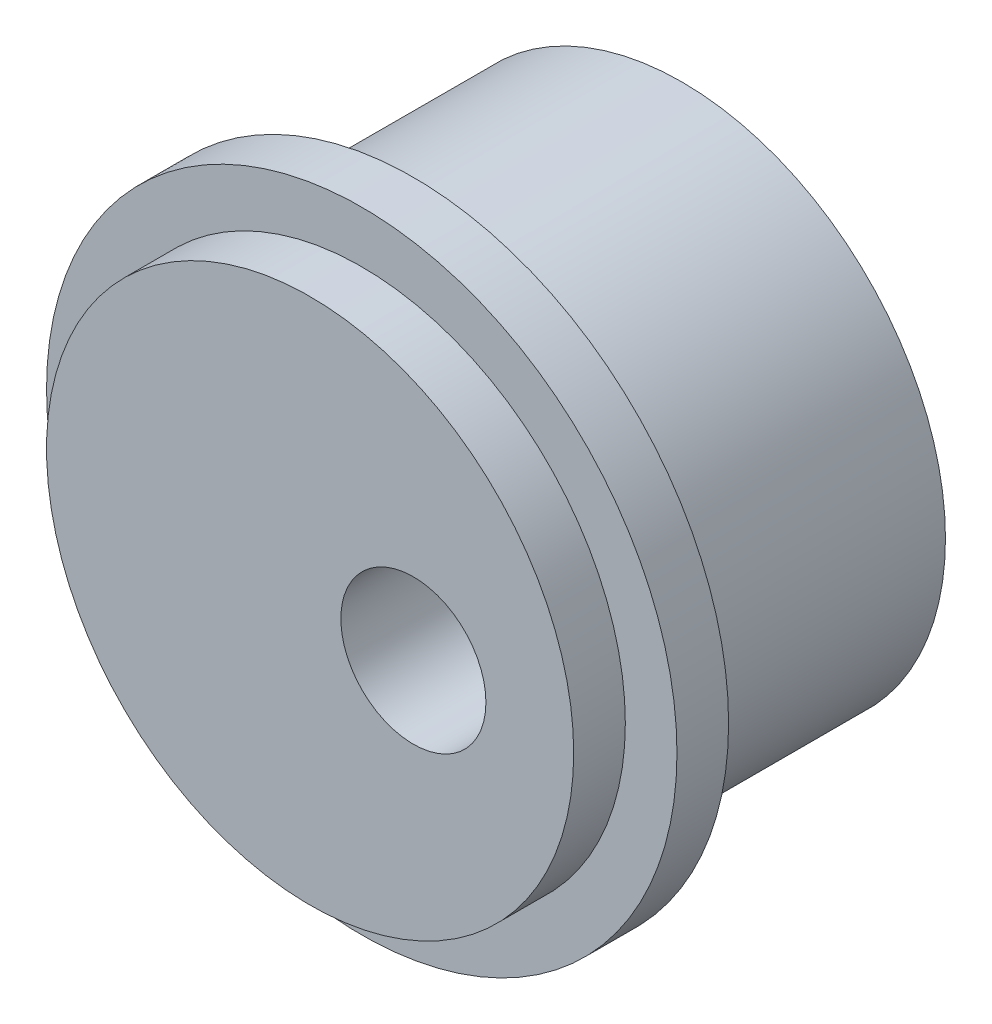
from build123d import *

# Parameters (mm, degrees)
SKETCH5_W           = 42.1
SKETCH5_H           = 42.1
SKETCH5_W_2         = 28.1
SKETCH5_H_2         = 28.1
BOSS_EXTRUDE3_DEPTH = 32
CUT_EXTRUDE2_REACH  = 80.495
SKETCH6_W           = 15
SKETCH6_H           = 10
SKETCH7_W           = 42.1
SKETCH7_H           = 42.1
SKETCH7_R           = 14.05
BOSS_EXTRUDE4_DEPTH = 40
CUT_EXTRUDE3_START  = -72
CUT_EXTRUDE3_DEPTH  = 72
CIRPATTERN1_COUNT   = 4
BOSS_EXTRUDE6_START = -72
SKETCH24_R          = 51.05
SKETCH24_R_2        = 21.05
BOSS_EXTRUDE6_DEPTH = 72
BOSS_EXTRUDE7_START = -20
SKETCH25_R          = 61.05
SKETCH25_R_2        = 51.05
BOSS_EXTRUDE7_DEPTH = 10


with BuildPart() as part:
    # Sketch5 → Boss-Extrude3 (new body)
    with BuildSketch(Plane.XY.offset(20)):
        with Locations((20, 0)):
            Rectangle(SKETCH5_W, SKETCH5_H)
        with Locations((20, 0)):
            Rectangle(SKETCH5_W_2, SKETCH5_H_2, mode=Mode.SUBTRACT)
    extrude(amount=BOSS_EXTRUDE3_DEPTH)

    # Sketch6 → Cut-Extrude2 (cut, up to next)
    with BuildSketch(Plane(origin=(0, 21.05, 0), x_dir=(1, 0, 0), z_dir=(0, 1, 0)), mode=Mode.PRIVATE) as cut_extrude2_sk1:
        with Locations((20, -27.5)):
            Rectangle(SKETCH6_W, SKETCH6_H)
    cut_extrude2_tool1 = extrude(cut_extrude2_sk1.sketch, amount=-CUT_EXTRUDE2_REACH, mode=Mode.PRIVATE) & part.part
    add(cut_extrude2_tool1.solids().sort_by_distance((20, 21.05, 27.5))[0], mode=Mode.SUBTRACT)

    # Sketch7 → Boss-Extrude4 (add)
    with BuildSketch(Plane.XY.offset(52)):
        with Locations((20, 0)):
            Rectangle(SKETCH7_W, SKETCH7_H)
        with Locations((20, 0)):
            Circle(SKETCH7_R, mode=Mode.SUBTRACT)
    extrude(amount=BOSS_EXTRUDE4_DEPTH)

    # Sketch11 → Cut-Extrude3 (cut)
    with BuildSketch(Plane.XY.offset(92).offset(CUT_EXTRUDE3_START)):
        with BuildLine():
            Line((20, 21.05), (-1.05, 21.05))
            Line((-1.05, 21.05), (-1.05, 0))
            ThreePointArc((-1.05, 0), (5.115402256, 14.884597744), (20, 21.05))
        make_face()
    cut_extrude3 = extrude(amount=CUT_EXTRUDE3_DEPTH, mode=Mode.SUBTRACT)

    # CirPattern1: Cut-Extrude3 ×4 about axis
    cirpattern1_axis = Axis((20, 0, 92), (0, 0, 1))
    for i in range(1, CIRPATTERN1_COUNT):
        add(cut_extrude3.rotate(cirpattern1_axis, i * 360 / CIRPATTERN1_COUNT), mode=Mode.SUBTRACT)

    # Sketch24 → Boss-Extrude6 (add)
    with BuildSketch(Plane.XY.offset(92).offset(BOSS_EXTRUDE6_START)):
        Circle(SKETCH24_R)
        with Locations((20, 0)):
            Circle(SKETCH24_R_2, mode=Mode.SUBTRACT)
    extrude(amount=BOSS_EXTRUDE6_DEPTH)

    # Sketch25 → Boss-Extrude7 (add)
    with BuildSketch(Plane.XY.offset(92).offset(BOSS_EXTRUDE7_START)):
        Circle(SKETCH25_R)
        Circle(SKETCH25_R_2, mode=Mode.SUBTRACT)
    extrude(amount=BOSS_EXTRUDE7_DEPTH)


solid = part.part
